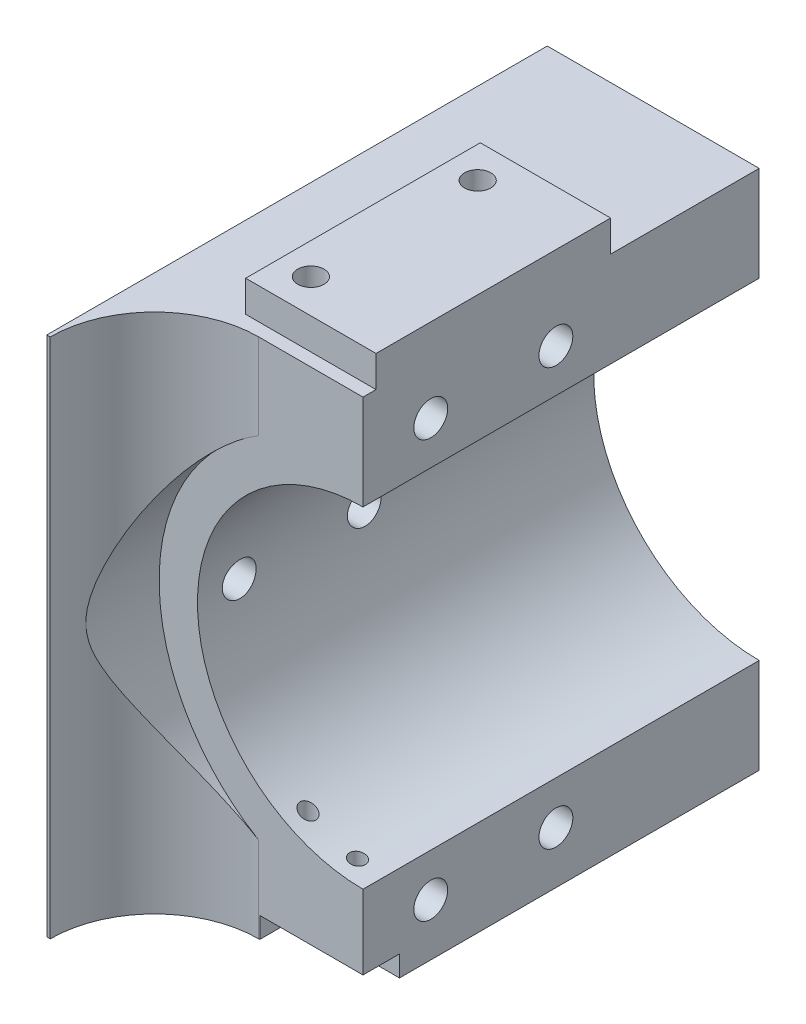
from build123d import *

# Parameters (mm, degrees)
CENTRE_HOLE_FOR_L2_DEPTH      = 40
CENTRE_HOLE_FOR_L2_DEPTH_BACK = 10
SKETCH1_R                     = 39.1
SKETCH1_R_2                   = 31.75
MAIN_STRUCTURE_DEPTH          = 60
MAIN_STRUCTURE_DEPTH_BACK     = 50
SKETCH2_W                     = 100
SKETCH2_H                     = 100
SKETCH2_R                     = 39.1
BEARING_CURVE_DEPTH           = 10
SKETCH6_R                     = 10.5
SHAFT_HOLE_DEPTH              = 10
WRIST_CUTOUT_DEPTH            = 188.082869339
SKETCH11_W                    = 25
SKETCH11_H                    = 45
SKETCH11_R                    = 2.525
BOSS_EXTRUDE1_DEPTH           = 6
SKETCH15_W                    = 19.8
SKETCH15_H                    = 7
CUT_EXTRUDE4_DEPTH            = 4
CUT_EXTRUDE5_REACH            = 190.16
CUT_EXTRUDE5_END_RADIUS       = 31.75
SKETCH16_R                    = 1.5
CUT_EXTRUDE6_DEPTH            = 168.7378908
CUT_EXTRUDE6_DEPTH_BACK       = 168.7378908
SKETCH18_R                    = 3.25
CUT_EXTRUDE7_START            = -1.5875
CUT_EXTRUDE7_DEPTH            = 1.5875
SKETCH9_R                     = 12.05
BEARING_DEPTH                 = 5
CUT_EXTRUDE8_DEPTH            = 3
SKETCH21_R                    = 3.25
SKETCH21_R_2                  = 1.65
CUT_EXTRUDE9_DEPTH            = 167.868211501
CUT_EXTRUDE10_DEPTH           = 6.35
SKETCH23_R                    = 2.275
CUT_EXTRUDE11_DEPTH           = 6
CHAMFER1_SIZE                 = 0.5
BOSS_EXTRUDE2_START           = 26
BOSS_EXTRUDE2_DEPTH           = 26


with BuildPart() as part:
    # Sketch1 → Centre Hole for L2 (new, two sides: drawn at the far end of the back side and taken through both)
    with BuildSketch(Plane.XY.offset(-CENTRE_HOLE_FOR_L2_DEPTH_BACK)):
        Circle(SKETCH1_R)
        Circle(SKETCH1_R_2, mode=Mode.SUBTRACT)
    extrude(amount=CENTRE_HOLE_FOR_L2_DEPTH + CENTRE_HOLE_FOR_L2_DEPTH_BACK)

    # Sketch2 → Main Structure (add, two sides: drawn at the far end of the back side and taken through both)
    with BuildSketch(Plane.XY.offset(40).offset(-MAIN_STRUCTURE_DEPTH_BACK)):
        Rectangle(SKETCH2_W, SKETCH2_H)
        Circle(SKETCH2_R, mode=Mode.SUBTRACT)
    extrude(amount=MAIN_STRUCTURE_DEPTH + MAIN_STRUCTURE_DEPTH_BACK)

    # Sketch3 → Bearing Curve (add)
    with BuildSketch(Plane.ZY.offset(50)):
        with BuildLine():
            Line((100, 50), (100, -50))
            ThreePointArc((100, -50), (150, 0), (100, 50))
        make_face()
    bearing_curve = extrude(amount=-BEARING_CURVE_DEPTH)

    # Upright Mirror: Bearing Curve across plane
    add(bearing_curve.mirror(Plane(origin=(0, 0, 0), x_dir=(0, 0, 1), z_dir=(1, 0, 0))))

    # Sketch6 → Shaft Hole (cut)
    with BuildSketch(Plane.ZY.offset(50)):
        with Locations((100, 0)):
            Circle(SKETCH6_R)
    extrude(amount=-SHAFT_HOLE_DEPTH, mode=Mode.SUBTRACT)

    # Sketch4 → Wrist Cutout (cut, through all)
    with BuildSketch(Plane(origin=(0, 50, 0), x_dir=(1, 0, 0), z_dir=(0, 1, 0))):
        with BuildLine():
            Line((-40, -100), (-40, -60))
            ThreePointArc((-40, -60), (-34.142135624, -45.857864376), (-20, -40))
            Line((-20, -40), (20, -40))
            ThreePointArc((20, -40), (34.142135624, -45.857864376), (40, -60))
            Line((40, -60), (40, -100))
            Line((40, -100), (-40, -100))
        make_face()
    extrude(amount=-WRIST_CUTOUT_DEPTH, mode=Mode.SUBTRACT)

    # SurfaceCut1
    split(bisect_by=Plane.ZY, keep=Keep.TOP)

    # Sketch11 → Boss-Extrude1 (add)
    with BuildSketch(Plane(origin=(0, 50, 0), x_dir=(1, 0, 0), z_dir=(0, 1, 0))):
        with Locations((-12.5, -15)):
            Rectangle(SKETCH11_W, SKETCH11_H)
        with Locations(Location((-19, 1, 0), (0, 0, 270))):
            Circle(SKETCH11_R, mode=Mode.SUBTRACT)
        with Locations(Location((-19, -31, 0), (0, 0, 270))):
            Circle(SKETCH11_R, mode=Mode.SUBTRACT)
    extrude(amount=BOSS_EXTRUDE1_DEPTH)

    # Sketch15 → Cut-Extrude4 (cut)
    with BuildSketch(Plane(origin=(0, -50, 0), x_dir=(-1, 0, 0), z_dir=(0, -1, 0))):
        with Locations((9.9, -36.5)):
            Rectangle(SKETCH15_W, SKETCH15_H)
    extrude(amount=-CUT_EXTRUDE4_DEPTH, mode=Mode.SUBTRACT)

    # Cut-Extrude5: up to this cylinder (the profile starts outside it)
    cut_extrude5_end = Plane(origin=(0, 0, 35.9), z_dir=(0, 0, 1)) * Cylinder(CUT_EXTRUDE5_END_RADIUS, 444.82, mode=Mode.PRIVATE)
    # Sketch16 → Cut-Extrude5 (cut, up to the surface)
    with BuildSketch(Plane(origin=(0, -46, 0), x_dir=(-1, 0, 0), z_dir=(0, -1, 0)), mode=Mode.PRIVATE) as cut_extrude5_sk1:
        with Locations(Location((14.65, -35.9, 0), (0, 0, 90))):
            Circle(SKETCH16_R)
    cut_extrude5_tool1 = extrude(cut_extrude5_sk1.sketch, amount=-CUT_EXTRUDE5_REACH, mode=Mode.PRIVATE) - cut_extrude5_end
    add(cut_extrude5_tool1.solids().sort_by_distance((-14.65, -46, 35.9))[0], mode=Mode.SUBTRACT)
    # Sketch16 → Cut-Extrude5 (cut, up to the surface)
    with BuildSketch(Plane(origin=(0, -46, 0), x_dir=(-1, 0, 0), z_dir=(0, -1, 0)), mode=Mode.PRIVATE) as cut_extrude5_sk2:
        with Locations(Location((5.15, -35.9, 0), (0, 0, 90))):
            Circle(SKETCH16_R)
    cut_extrude5_tool2 = extrude(cut_extrude5_sk2.sketch, amount=-CUT_EXTRUDE5_REACH, mode=Mode.PRIVATE) - cut_extrude5_end
    add(cut_extrude5_tool2.solids().sort_by_distance((-5.15, -46, 35.9))[0], mode=Mode.SUBTRACT)

    # Sketch18 → Cut-Extrude6 (cut, two sides: drawn at the far end of the back side and taken through both)
    with BuildSketch(Plane.ZY.offset(50).offset(-CUT_EXTRUDE6_DEPTH_BACK)):
        with Locations((8, 0)):
            Circle(SKETCH18_R)
        with Locations((32, 0)):
            Circle(SKETCH18_R)
    extrude(amount=CUT_EXTRUDE6_DEPTH + CUT_EXTRUDE6_DEPTH_BACK, mode=Mode.SUBTRACT)

    # Sketch19 → Cut-Extrude7 (cut)
    with BuildSketch(Plane(origin=(-40, 0, 0), x_dir=(0, 0, -1), z_dir=(1, 0, 0)).offset(CUT_EXTRUDE7_START)):
        with BuildLine():
            Line((-60, 50), (-100, 50))
            ThreePointArc((-100, 50), (-150, 0), (-100, -50))
            Line((-100, -50), (-60, -50))
            Line((-60, -50), (-60, 50))
        make_face()
    extrude(amount=CUT_EXTRUDE7_DEPTH, mode=Mode.SUBTRACT)

    # Sketch9 → Bearing (cut)
    with BuildSketch(Plane(origin=(-41.5875, 0, 0), x_dir=(0, 0, -1), z_dir=(1, 0, 0))):
        with Locations((-100, 0)):
            Circle(SKETCH9_R)
    extrude(amount=-BEARING_DEPTH, mode=Mode.SUBTRACT)

    # Sketch20 → Cut-Extrude8 (cut)
    with BuildSketch(Plane.ZY.offset(50)):
        with BuildLine():
            Line((-10, -50), (100, -50))
            ThreePointArc((100, -50), (150, 0), (100, 50))
            Line((100, 50), (-10, 50))
            Line((-10, 50), (-10, -50))
        make_face()
    extrude(amount=-CUT_EXTRUDE8_DEPTH, mode=Mode.SUBTRACT)

    # Sketch21 → Cut-Extrude9 (cut, through all)
    with BuildSketch(Plane.ZY.offset(47)):
        with Locations((3, -40)):
            Circle(SKETCH21_R)
        with Locations((27, -40)):
            Circle(SKETCH21_R)
        with Locations(Location((27, 40, 0), (0, 0, 180))):
            Circle(SKETCH21_R)
        with Locations(Location((3, 40, 0), (0, 0, 180))):
            Circle(SKETCH21_R)
        with Locations((125, 0)):
            Circle(SKETCH21_R_2)
    extrude(amount=-CUT_EXTRUDE9_DEPTH, mode=Mode.SUBTRACT)

    # Sketch22 → Cut-Extrude10 (cut)
    with BuildSketch(Plane.ZY.offset(47)):
        with BuildLine():
            Line((-10, 50), (-10, -50))
            Line((-10, -50), (100, -50))
            ThreePointArc((100, -50), (150, 0), (100, 50))
            Line((100, 50), (-10, 50))
        make_face()
    extrude(amount=-CUT_EXTRUDE10_DEPTH, mode=Mode.SUBTRACT)

    # Sketch23 → Cut-Extrude11 (cut)
    with BuildSketch(Plane(origin=(0, -50, 0), x_dir=(-1, 0, 0), z_dir=(0, -1, 0))):
        with Locations(Location((15, 3.25, 0), (0, 0, 90))):
            Circle(SKETCH23_R)
    extrude(amount=-CUT_EXTRUDE11_DEPTH, mode=Mode.SUBTRACT)

    # Chamfer1
    chamfer1_edges = [part.edges().sort_by_distance(p)[0] for p in [
        (-15, -50, -0.975),
    ]]
    chamfer(chamfer1_edges, length=CHAMFER1_SIZE)

    # Sketch24 → Boss-Extrude2 (add)
    with BuildSketch(Plane(origin=(0, 0, -10), x_dir=(-1, 0, 0), z_dir=(0, 0, -1)).offset(BOSS_EXTRUDE2_START)):
        with BuildLine():
            Line((40.65, -50), (40.65, 50))
            Line((40.65, 50), (0, 50))
            Line((0, 50), (0, 31.75))
            ThreePointArc((0, 31.75), (31.75, 0), (0, -31.75))
            Line((0, -31.75), (0, -50))
            Line((0, -50), (40.65, -50))
        make_face()
    extrude(amount=-BOSS_EXTRUDE2_DEPTH)


solid = part.part
